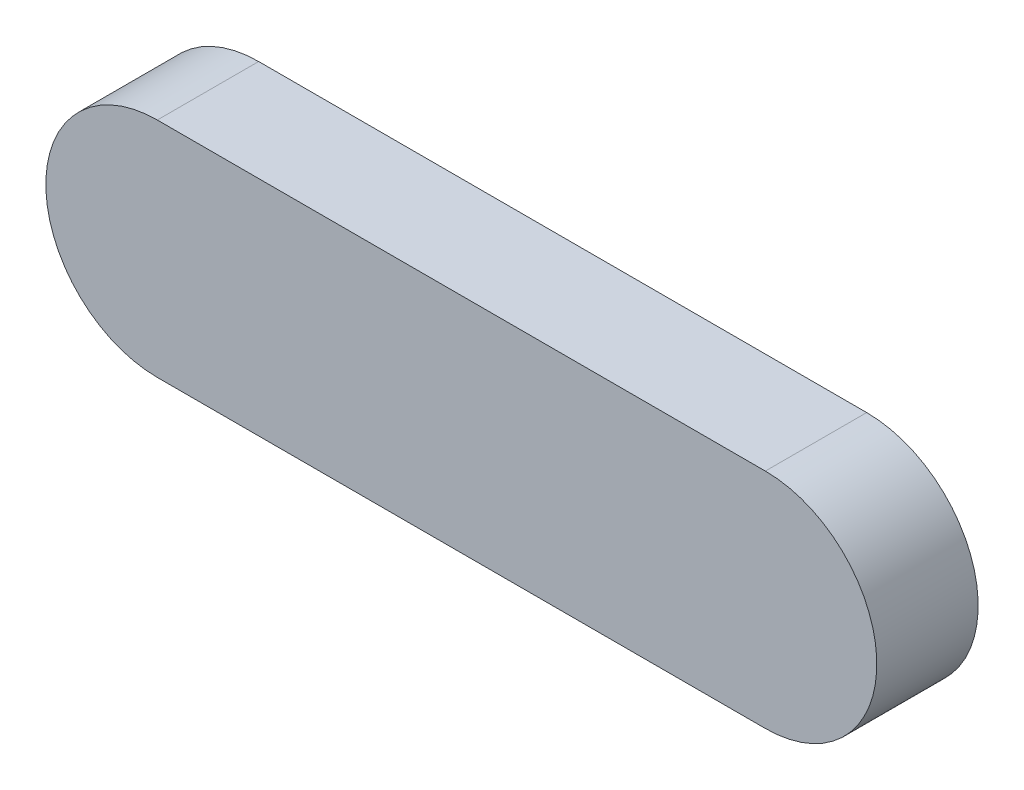
from build123d import *

# Parameters (mm, degrees)
ROCKERLINK_DEPTH = 10


with BuildPart() as part:
    # 草图3 → RockerLink (new body)
    with BuildSketch(Plane.XY):
        with BuildLine():
            Line((20, 61), (80, 61))
            ThreePointArc((80, 61), (91, 50), (80, 39))
            Line((80, 39), (20, 39))
            ThreePointArc((20, 39), (9, 50), (20, 61))
        make_face()
    extrude(amount=ROCKERLINK_DEPTH)


solid = part.part
